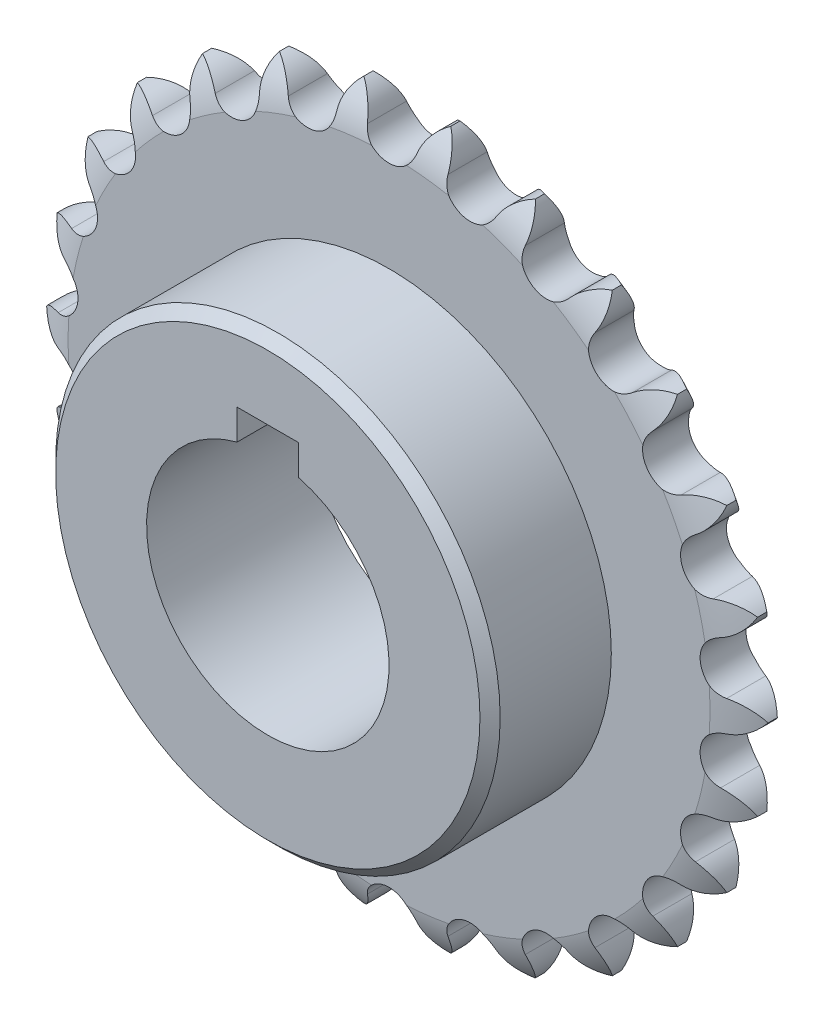
from build123d import *

# Parameters (mm, degrees)
SKETCH1_R           = 19.05
BOSS_EXTRUDE2_DEPTH = 7.213
SKETCH2_W           = 19.05
SKETCH2_H           = 15.875
SKETCH3_W           = 9.652
SKETCH3_H           = 4.7625
CUT_EXTRUDE1_DEPTH  = 85.075305158
CHAMFER1_SIZE       = 1.5875


with BuildPart() as part:
    # Sketch1 → Boss-Extrude2 (new body)
    with BuildSketch(Plane.XY):
        with BuildLine():
            ThreePointArc((3.92972164, 52.414466532), (0, 49.2633), (-3.92972164, 52.414466532))
            ThreePointArc((-3.92972164, 52.414466532), (-4.963717242, 54.655608441), (-6.832202969, 56.268253798))
            ThreePointArc((-6.832202969, 56.268253798), (-8.260462601, 54.255311081), (-8.728071805, 51.831841339))
            ThreePointArc((-8.728071805, 51.831841339), (-11.789479364, 47.831798034), (-16.359133948, 49.950953449))
            ThreePointArc((-16.359133948, 49.950953449), (-17.899423881, 51.879520503), (-20.099546103, 52.998147414))
            ThreePointArc((-20.099546103, 52.998147414), (-21.004574383, 50.701892251), (-20.878621442, 48.236937928))
            ThreePointArc((-20.878621442, 48.236937928), (-22.893797041, 43.620485829), (-27.837812853, 44.584472516))
            ThreePointArc((-27.837812853, 44.584472516), (-29.794881066, 46.088383408), (-32.198776677, 46.647981343))
            ThreePointArc((-32.198776677, 46.647981343), (-32.52797665, 44.201863738), (-31.815781492, 41.838679019))
            ThreePointArc((-31.815781492, 41.838679019), (-32.66761045, 36.87410954), (-37.698659262, 36.626904099))
            ThreePointArc((-37.698659262, 36.626904099), (-39.958768064, 37.618756993), (-42.426731389, 37.586804154))
            ThreePointArc((-42.426731389, 37.586804154), (-42.160971149, 35.132983571), (-40.903923967, 33.008908163))
            ThreePointArc((-40.903923967, 33.008908163), (-40.542901081, 27.984744038), (-45.368596624, 26.540713148))
            ThreePointArc((-45.368596624, 26.540713148), (-47.800396705, 26.962865161), (-50.188998687, 26.341218531))
            ThreePointArc((-50.188998687, 26.341218531), (-49.343723254, 24.022302103), (-47.614879061, 22.260779547))
            ThreePointArc((-47.614879061, 22.260779547), (-46.061985668, 17.469006932), (-50.401876058, 14.912072421))
            ThreePointArc((-50.401876058, 14.912072421), (-52.864040038, 14.739989612), (-55.034463811, 13.564777033))
            ThreePointArc((-55.034463811, 13.564777033), (-53.65879752, 11.515531753), (-51.558630457, 10.218935338))
            ThreePointArc((-51.558630457, 10.218935338), (-48.904115077, 5.93803464), (-52.505981658, 2.416796248))
            ThreePointArc((-52.505981658, 2.416796248), (-54.855417516, 1.660479444), (-56.68152594, 0))
            ThreePointArc((-56.68152594, 0), (-54.855417516, -1.660479444), (-52.505981658, -2.416796248))
            ThreePointArc((-52.505981658, -2.416796248), (-48.904115077, -5.93803464), (-51.558630457, -10.218935338))
            ThreePointArc((-51.558630457, -10.218935338), (-53.65879752, -11.515531753), (-55.034463811, -13.564777033))
            ThreePointArc((-55.034463811, -13.564777033), (-52.864040038, -14.739989612), (-50.401876058, -14.912072421))
            ThreePointArc((-50.401876058, -14.912072421), (-46.061985668, -17.469006932), (-47.614879061, -22.260779547))
            ThreePointArc((-47.614879061, -22.260779547), (-49.343723254, -24.022302103), (-50.188998687, -26.341218531))
            ThreePointArc((-50.188998687, -26.341218531), (-47.800396705, -26.962865161), (-45.368596624, -26.540713148))
            ThreePointArc((-45.368596624, -26.540713148), (-40.542901081, -27.984744038), (-40.903923967, -33.008908163))
            ThreePointArc((-40.903923967, -33.008908163), (-42.160971149, -35.132983571), (-42.426731389, -37.586804154))
            ThreePointArc((-42.426731389, -37.586804154), (-39.958768064, -37.618756993), (-37.698659262, -36.626904099))
            ThreePointArc((-37.698659262, -36.626904099), (-32.66761045, -36.87410954), (-31.815781492, -41.838679019))
            ThreePointArc((-31.815781492, -41.838679019), (-32.52797665, -44.201863738), (-32.198776677, -46.647981343))
            ThreePointArc((-32.198776677, -46.647981343), (-29.794881066, -46.088383408), (-27.837812853, -44.584472516))
            ThreePointArc((-27.837812853, -44.584472516), (-22.893797041, -43.620485829), (-20.878621442, -48.236937928))
            ThreePointArc((-20.878621442, -48.236937928), (-21.004574383, -50.701892251), (-20.099546103, -52.998147414))
            ThreePointArc((-20.099546103, -52.998147414), (-17.899423881, -51.879520503), (-16.359133948, -49.950953449))
            ThreePointArc((-16.359133948, -49.950953449), (-11.789479364, -47.831798034), (-8.728071805, -51.831841339))
            ThreePointArc((-8.728071805, -51.831841339), (-8.260462601, -54.255311081), (-6.832202969, -56.268253798))
            ThreePointArc((-6.832202969, -56.268253798), (-4.963717242, -54.655608441), (-3.92972164, -52.414466532))
            ThreePointArc((-3.92972164, -52.414466532), (0, -49.2633), (3.92972164, -52.414466532))
            ThreePointArc((3.92972164, -52.414466532), (4.963717242, -54.655608441), (6.832202969, -56.268253798))
            ThreePointArc((6.832202969, -56.268253798), (8.260462601, -54.255311081), (8.728071805, -51.831841339))
            ThreePointArc((8.728071805, -51.831841339), (11.789479364, -47.831798034), (16.359133948, -49.950953449))
            ThreePointArc((16.359133948, -49.950953449), (17.899423881, -51.879520503), (20.099546103, -52.998147414))
            ThreePointArc((20.099546103, -52.998147414), (21.004574383, -50.701892251), (20.878621442, -48.236937928))
            ThreePointArc((20.878621442, -48.236937928), (22.893797041, -43.620485829), (27.837812853, -44.584472516))
            ThreePointArc((27.837812853, -44.584472516), (29.794881066, -46.088383408), (32.198776677, -46.647981343))
            ThreePointArc((32.198776677, -46.647981343), (32.52797665, -44.201863738), (31.815781492, -41.838679019))
            ThreePointArc((31.815781492, -41.838679019), (32.66761045, -36.87410954), (37.698659262, -36.626904099))
            ThreePointArc((37.698659262, -36.626904099), (39.958768064, -37.618756993), (42.426731389, -37.586804154))
            ThreePointArc((42.426731389, -37.586804154), (42.160971149, -35.132983571), (40.903923967, -33.008908163))
            ThreePointArc((40.903923967, -33.008908163), (40.542901081, -27.984744038), (45.368596624, -26.540713148))
            ThreePointArc((45.368596624, -26.540713148), (47.800396705, -26.962865161), (50.188998687, -26.341218531))
            ThreePointArc((50.188998687, -26.341218531), (49.343723254, -24.022302103), (47.614879061, -22.260779547))
            ThreePointArc((47.614879061, -22.260779547), (46.061985668, -17.469006932), (50.401876058, -14.912072421))
            ThreePointArc((50.401876058, -14.912072421), (52.864040038, -14.739989612), (55.034463811, -13.564777033))
            ThreePointArc((55.034463811, -13.564777033), (53.65879752, -11.515531753), (51.558630457, -10.218935338))
            ThreePointArc((51.558630457, -10.218935338), (48.904115077, -5.93803464), (52.505981658, -2.416796248))
            ThreePointArc((52.505981658, -2.416796248), (54.855417516, -1.660479444), (56.68152594, 0))
            ThreePointArc((56.68152594, 0), (54.855417516, 1.660479444), (52.505981658, 2.416796248))
            ThreePointArc((52.505981658, 2.416796248), (48.904115077, 5.93803464), (51.558630457, 10.218935338))
            ThreePointArc((51.558630457, 10.218935338), (53.65879752, 11.515531753), (55.034463811, 13.564777033))
            ThreePointArc((55.034463811, 13.564777033), (52.864040038, 14.739989612), (50.401876058, 14.912072421))
            ThreePointArc((50.401876058, 14.912072421), (46.061985668, 17.469006932), (47.614879061, 22.260779547))
            ThreePointArc((47.614879061, 22.260779547), (49.343723254, 24.022302103), (50.188998687, 26.341218531))
            ThreePointArc((50.188998687, 26.341218531), (47.800396705, 26.962865161), (45.368596624, 26.540713148))
            ThreePointArc((45.368596624, 26.540713148), (40.542901081, 27.984744038), (40.903923967, 33.008908163))
            ThreePointArc((40.903923967, 33.008908163), (42.160971149, 35.132983571), (42.426731389, 37.586804154))
            ThreePointArc((42.426731389, 37.586804154), (39.958768064, 37.618756993), (37.698659262, 36.626904099))
            ThreePointArc((37.698659262, 36.626904099), (32.66761045, 36.87410954), (31.815781492, 41.838679019))
            ThreePointArc((31.815781492, 41.838679019), (32.52797665, 44.201863738), (32.198776677, 46.647981343))
            ThreePointArc((32.198776677, 46.647981343), (29.794881066, 46.088383408), (27.837812853, 44.584472516))
            ThreePointArc((27.837812853, 44.584472516), (22.893797041, 43.620485829), (20.878621442, 48.236937928))
            ThreePointArc((20.878621442, 48.236937928), (21.004574383, 50.701892251), (20.099546103, 52.998147414))
            ThreePointArc((20.099546103, 52.998147414), (17.899423881, 51.879520503), (16.359133948, 49.950953449))
            ThreePointArc((16.359133948, 49.950953449), (11.789479364, 47.831798034), (8.728071805, 51.831841339))
            ThreePointArc((8.728071805, 51.831841339), (8.260462601, 54.255311081), (6.832202969, 56.268253798))
            ThreePointArc((6.832202969, 56.268253798), (4.963717242, 54.655608441), (3.92972164, 52.414466532))
        make_face()
        Circle(SKETCH1_R, mode=Mode.SUBTRACT)
    extrude(amount=BOSS_EXTRUDE2_DEPTH)

    # Sketch2 → Revolve1 (revolve)
    with BuildSketch(Plane(origin=(0, 0, 0), x_dir=(0, 0, -1), z_dir=(1, 0, 0))):
        with Locations((-16.738, 26.9875)):
            Rectangle(SKETCH2_W, SKETCH2_H)
    revolve(axis=Axis((0, 0, 0), (0, 0, 1)))

    # Sketch3 → Cut-Extrude1 (cut, through all)
    with BuildSketch(Plane.XY.offset(26.263)):
        with Locations((0, 20.809820862)):
            Rectangle(SKETCH3_W, SKETCH3_H)
    extrude(amount=-CUT_EXTRUDE1_DEPTH, mode=Mode.SUBTRACT)

    # Sketch4 → Cut-Revolve1 (revolve, cut)
    with BuildSketch(Plane(origin=(0, 0, 0), x_dir=(0, 0, -1), z_dir=(1, 0, 0))):
        with BuildLine():
            Line((-13.849663087, 50.419), (-7.213, 50.419))
            ThreePointArc((-7.213, 50.419), (-6.14626636, 53.874921257), (-4.148614598, 56.89))
            Line((-4.148614598, 56.89), (-13.849663087, 56.89))
            Line((-13.849663087, 56.89), (-13.849663087, 50.419))
        make_face()
        with BuildLine():
            Line((6.636663087, 50.419), (6.636663087, 56.89))
            Line((6.636663087, 56.89), (-3.064385402, 56.89))
            ThreePointArc((-3.064385402, 56.89), (-1.06673364, 53.874921257), (0, 50.419))
            Line((0, 50.419), (6.636663087, 50.419))
        make_face()
    revolve(axis=Axis((0, 0, 0), (0, 0, -1)), mode=Mode.SUBTRACT)

    # Chamfer1
    chamfer1_edges = [part.edges().sort_by_distance(p)[0] for p in [
        (0, -34.925, 26.263),
    ]]
    chamfer(chamfer1_edges, length=CHAMFER1_SIZE)


solid = part.part
